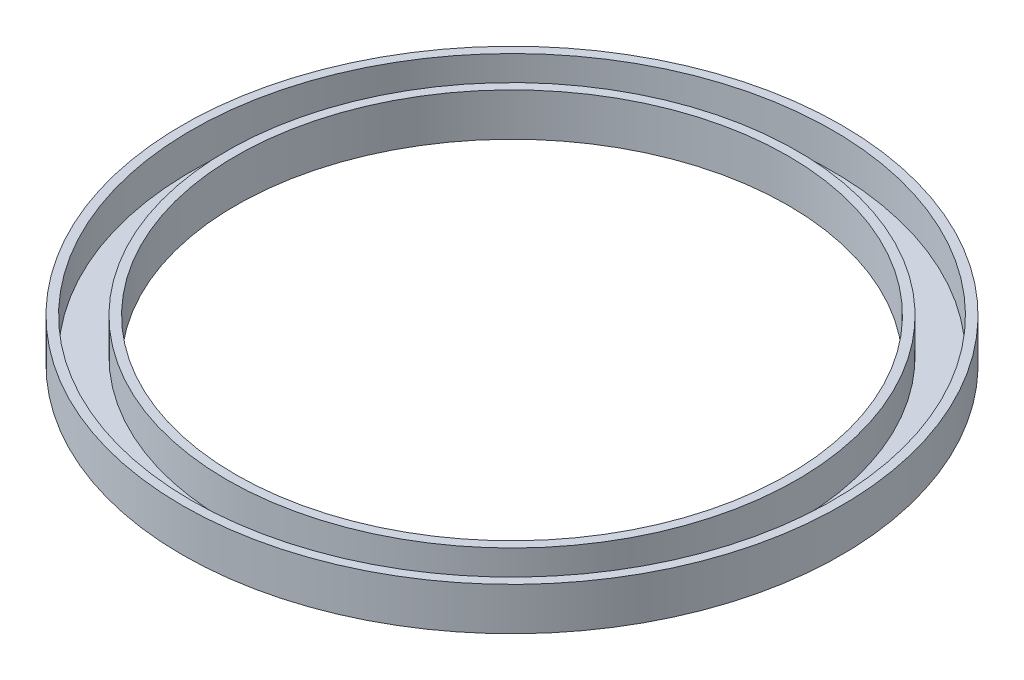
from build123d import *

# Parameters (mm, degrees)
SKETCH_1_R      = 90
SKETCH_1_R_2    = 80
EXTRUDE_1_DEPTH = 2
SKETCH_1_3_R    = 92.5
SKETCH_1_3_R_2  = 90
SKETCH_1_3_R_3  = 80
SKETCH_1_3_R_4  = 77.5
EXTRUDE_2_DEPTH = 12


with BuildPart() as part:
    # 草图1 → 凸台-拉伸1 (new body)
    with BuildSketch(Plane(origin=(0, 0, 0), x_dir=(1, 0, 0), z_dir=(0, 1, 0))):
        Circle(SKETCH_1_R)
        Circle(SKETCH_1_R_2, mode=Mode.SUBTRACT)
    extrude(amount=EXTRUDE_1_DEPTH)

    # 草图1<3> → 凸台-拉伸2 (add)
    # profile 1 of 2: a face of its own
    with BuildSketch(Plane(origin=(0, 0, 0), x_dir=(1, 0, 0), z_dir=(0, 1, 0))):
        Circle(SKETCH_1_3_R)
        Circle(SKETCH_1_3_R_2, mode=Mode.SUBTRACT)
    # profile 2 of 2: a face of its own
    with BuildSketch(Plane(origin=(0, 0, 0), x_dir=(1, 0, 0), z_dir=(0, 1, 0))):
        Circle(SKETCH_1_3_R_3)
        Circle(SKETCH_1_3_R_4, mode=Mode.SUBTRACT)
    extrude(amount=EXTRUDE_2_DEPTH)


solid = part.part
